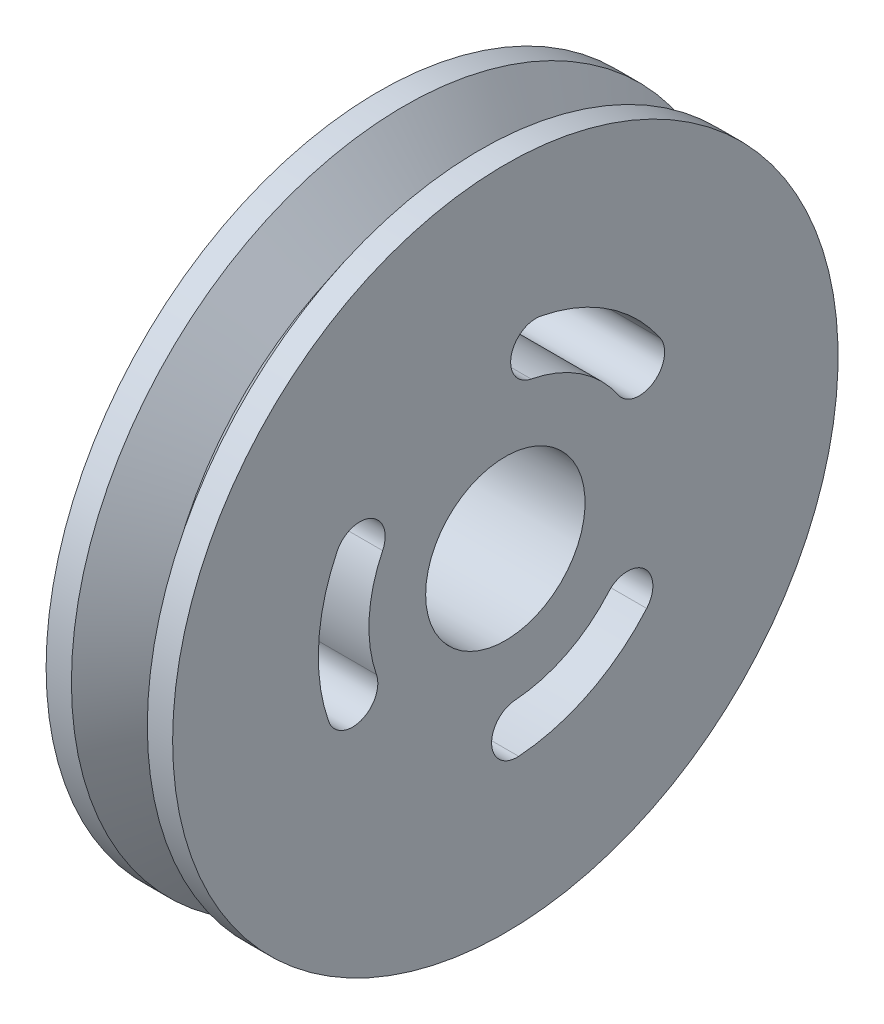
from build123d import *

# Parameters (mm, degrees)
CUT_EXTRUDE1_DEPTH      = 25.4561342
CUT_EXTRUDE1_DEPTH_BACK = 25.4561342


with BuildPart() as part:
    # Sketch1 → Revolve1 (revolve)
    with BuildSketch(Plane.XY, mode=Mode.PRIVATE) as revolve1_sk:
        Polygon((1.27, 16.7), (3.175, 14.16), (5.08, 16.7), (6.35, 16.7), (6.35, 4), (0, 4), (0, 16.7), align=None)
    revolve(revolve1_sk.sketch.rotate(Axis((0, 0, 0), (1, 0, 0)), 90), axis=Axis((0, 0, 0), (1, 0, 0)))

    # Sketch2 → Cut-Extrude1 (cut, two sides: drawn at the far end of the back side and taken through both)
    with BuildSketch(Plane.ZY.offset(-CUT_EXTRUDE1_DEPTH_BACK)):
        with BuildLine():
            ThreePointArc((-5.174909182, -4.484253782), (-6.96638667, -4.356158459), (-7.094481993, -6.147635947))
            ThreePointArc((-7.094481993, -6.147635947), (-4.201848282, -8.394615744), (-0.66952126, -9.363591392))
            ThreePointArc((-0.66952126, -9.363591392), (0.687821691, -8.187402584), (-0.488367117, -6.830059633))
            ThreePointArc((-0.488367117, -6.830059633), (-3.064943047, -6.123262296), (-5.174909182, -4.484253782))
        make_face()
        with BuildLine():
            ThreePointArc((-1.296023102, 6.723729704), (-0.289350555, 8.211147057), (-1.776767907, 9.217819605))
            ThreePointArc((-1.776767907, 9.217819605), (-5.169026349, 7.836215226), (-7.774347387, 5.261618115))
            ThreePointArc((-7.774347387, 5.261618115), (-7.434409475, 3.498030233), (-5.670821594, 3.837968145))
            ThreePointArc((-5.670821594, 3.837968145), (-3.77042918, 5.715949687), (-1.296023102, 6.723729704))
        make_face()
        with BuildLine():
            ThreePointArc((6.470932282, -2.239475923), (7.255737222, -3.854988599), (8.871249898, -3.070183659))
            ThreePointArc((8.871249898, -3.070183659), (9.370874629, 0.558400517), (8.443868645, 4.101973277))
            ThreePointArc((8.443868645, 4.101973277), (6.746587782, 4.68937235), (6.159188708, 2.992091487))
            ThreePointArc((6.159188708, 2.992091487), (6.835372224, 0.407312608), (6.470932282, -2.239475923))
        make_face()
    extrude(amount=CUT_EXTRUDE1_DEPTH + CUT_EXTRUDE1_DEPTH_BACK, mode=Mode.SUBTRACT)


solid = part.part
